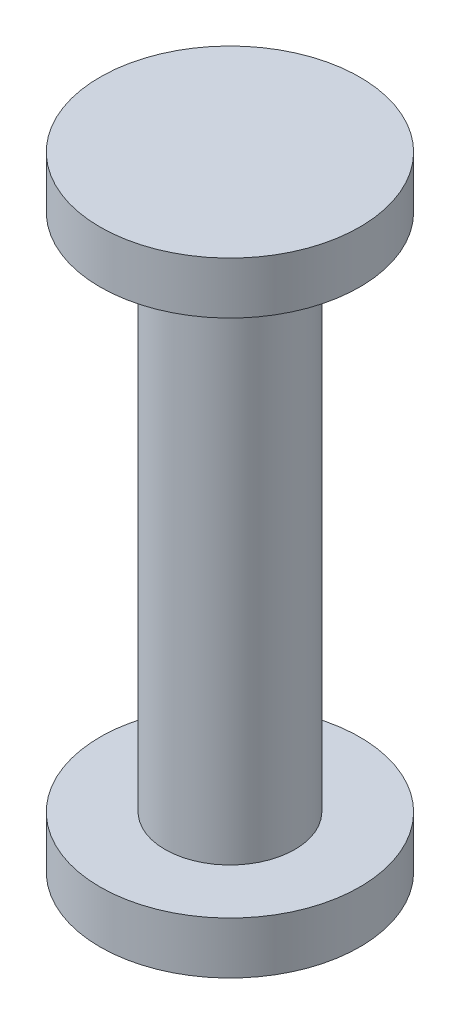
from build123d import *


with BuildPart() as part:
    # Sketch1 → Revolve1 (revolve)
    with BuildSketch(Plane.XY):
        Polygon((3.175, 7.62), (0, 7.62), (0, -7.62), (3.175, -7.62), (3.175, -6.35), (1.5875, -6.35), (1.5875, 6.35), (3.175, 6.35), align=None)
    revolve(axis=Axis((0, 55, 0), (0, -1, 0)))


solid = part.part
